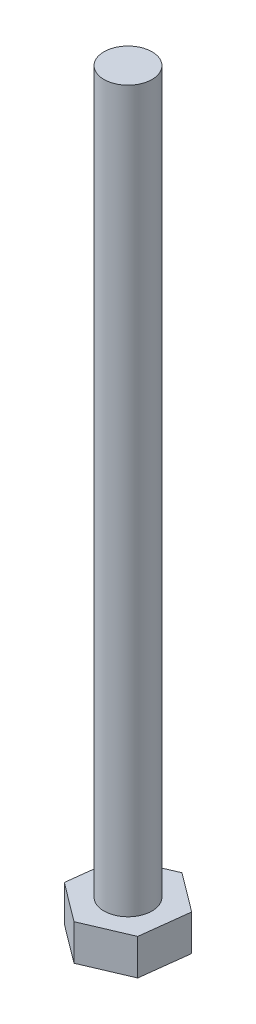
from build123d import *

# Parameters (mm, degrees)
BOSS_EXTRUDE1_DEPTH = 3
SKETCH2_R           = 2
BOSS_EXTRUDE2_DEPTH = 60


with BuildPart() as part:
    # Sketch1 → Boss-Extrude1 (new body)
    with BuildSketch(Plane(origin=(0, 0, 0), x_dir=(1, 0, 0), z_dir=(0, 1, 0))):
        Polygon((3.233161507, -2.424871131), (3.716580754, 1.587564435), (0.483419246, 4.012435565), (-3.233161507, 2.424871131), (-3.716580754, -1.587564435), (-0.483419246, -4.012435565), align=None)
    extrude(amount=BOSS_EXTRUDE1_DEPTH)

    # Sketch2 → Boss-Extrude2 (add)
    with BuildSketch(Plane(origin=(0, 3, 0), x_dir=(1, 0, 0), z_dir=(0, 1, 0))):
        with Locations(Location((0, 0, 0), (0, 0, 270))):
            Circle(SKETCH2_R)
    extrude(amount=BOSS_EXTRUDE2_DEPTH)


solid = part.part
